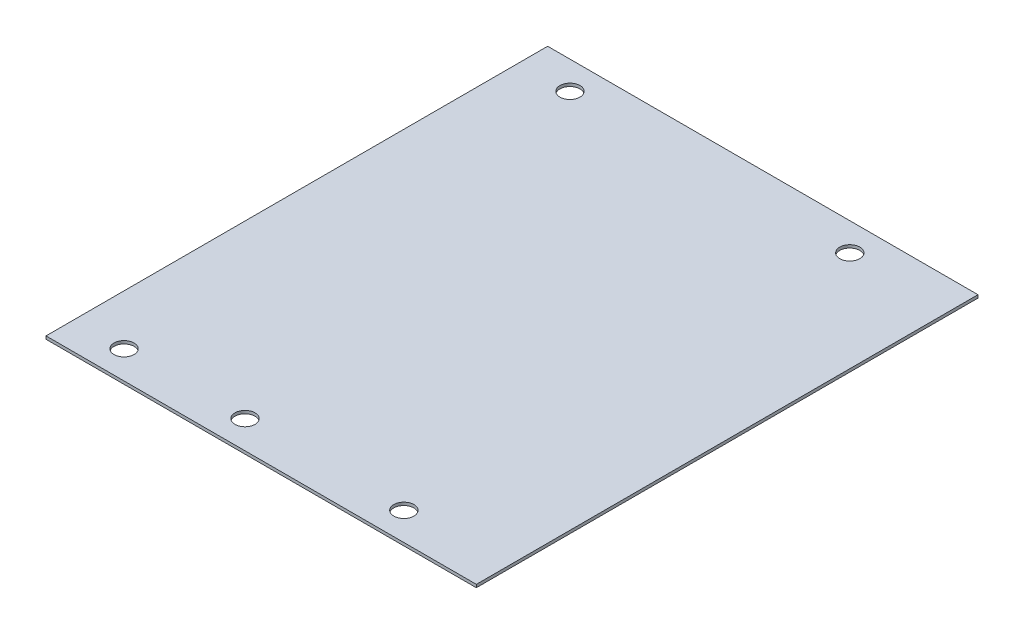
from build123d import *

# Parameters (mm, degrees)
CROQUIS1_W              = 386
CROQUIS1_H              = 450
SALIENTE_EXTRUIR1_DEPTH = 2.66
CROQUIS2_R              = 9
CORTAR_EXTRUIR1_DEPTH   = 3


with BuildPart() as part:
    # Croquis1 → Saliente-Extruir1 (new body)
    with BuildSketch(Plane(origin=(0, 0, 0), x_dir=(1, 0, 0), z_dir=(0, 1, 0))):
        Rectangle(CROQUIS1_W, CROQUIS1_H)
    extrude(amount=SALIENTE_EXTRUIR1_DEPTH)

    # Croquis2 → Cortar-Extruir1 (cut)
    with BuildSketch(Plane(origin=(0, 2.66, 0), x_dir=(1, 0, 0), z_dir=(0, 1, 0))):
        with Locations(Location((-148, 200, 0), (0, 0, 270))):
            Circle(CROQUIS2_R)
        with Locations(Location((103, 200, 0), (0, 0, 270))):
            Circle(CROQUIS2_R)
        with Locations(Location((-148, -200, 0), (0, 0, 270))):
            Circle(CROQUIS2_R)
        with Locations(Location((-39.5, -200, 0), (0, 0, 270))):
            Circle(CROQUIS2_R)
        with Locations(Location((103, -200, 0), (0, 0, 270))):
            Circle(CROQUIS2_R)
    extrude(amount=-CORTAR_EXTRUIR1_DEPTH, mode=Mode.SUBTRACT)


solid = part.part
